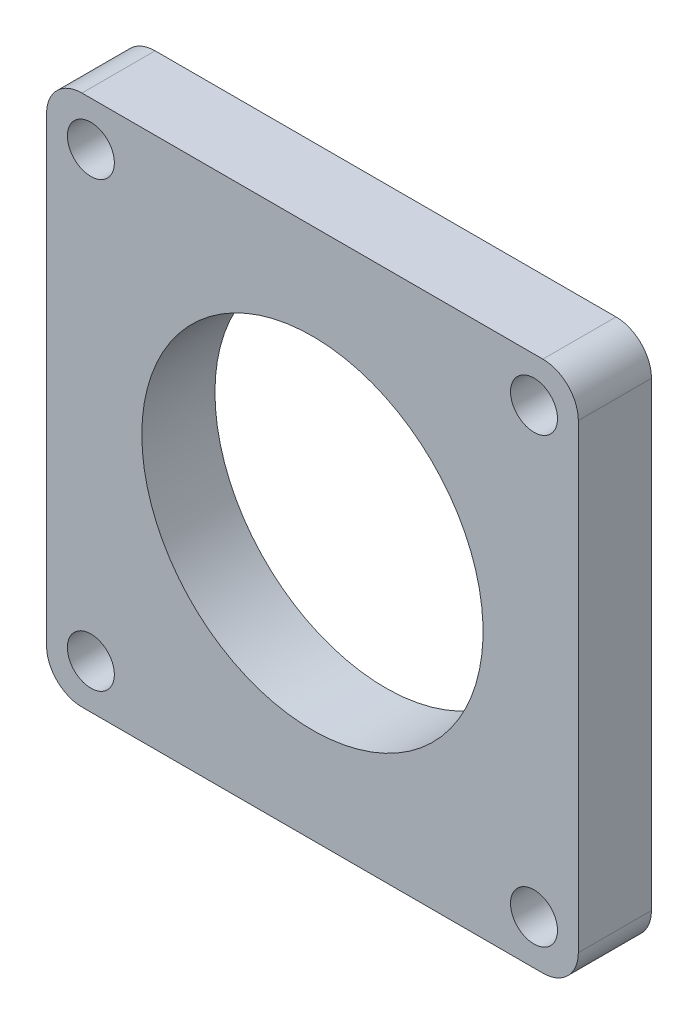
from build123d import *

# Parameters (mm, degrees)
SKETCH1_R           = 19.25
SKETCH1_R_2         = 2.65
BOSS_EXTRUDE1_DEPTH = 4.125


with BuildPart() as part:
    # Sketch1 → Boss-Extrude1 (new, symmetric)
    with BuildSketch(Plane.XY):
        with BuildLine():
            Line((30, -26), (30, 26))
            ThreePointArc((30, 26), (28.828427125, 28.828427125), (26, 30))
            Line((26, 30), (-26, 30))
            ThreePointArc((-26, 30), (-28.828427125, 28.828427125), (-30, 26))
            Line((-30, 26), (-30, -26))
            ThreePointArc((-30, -26), (-28.828427125, -28.828427125), (-26, -30))
            Line((-26, -30), (26, -30))
            ThreePointArc((26, -30), (28.828427125, -28.828427125), (30, -26))
        make_face()
        with Locations(Location((0, 0, 0), (0, 0, 180))):
            Circle(SKETCH1_R, mode=Mode.SUBTRACT)
        with Locations(Location((-25, -25, 0), (0, 0, 180))):
            Circle(SKETCH1_R_2, mode=Mode.SUBTRACT)
        with Locations(Location((-25, 25, 0), (0, 0, 180))):
            Circle(SKETCH1_R_2, mode=Mode.SUBTRACT)
        with Locations(Location((25, -25, 0), (0, 0, 180))):
            Circle(SKETCH1_R_2, mode=Mode.SUBTRACT)
        with Locations(Location((25, 25, 0), (0, 0, 180))):
            Circle(SKETCH1_R_2, mode=Mode.SUBTRACT)
    extrude(amount=BOSS_EXTRUDE1_DEPTH, both=True)


solid = part.part
